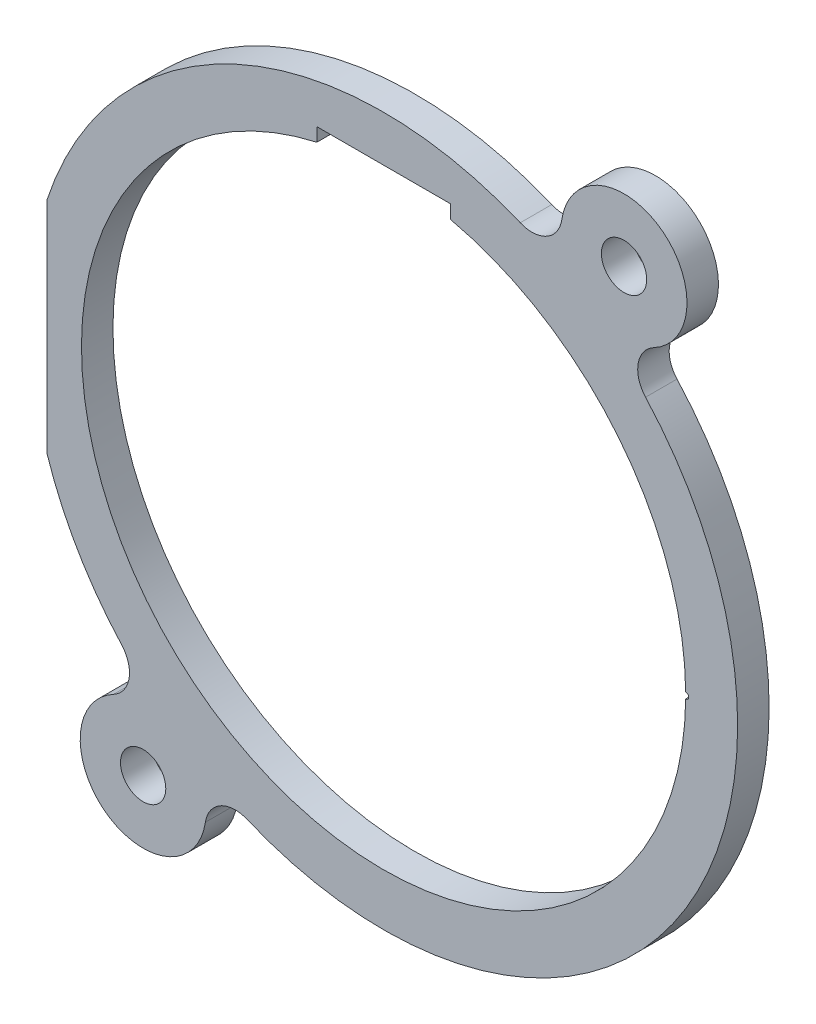
from build123d import *

# Parameters (mm, degrees)
SKETCH1_R           = 1.143
BOSS_EXTRUDE1_DEPTH = 1.5875


with BuildPart() as part:
    # Sketch1 → Boss-Extrude1 (new body)
    with BuildSketch(Plane.XY):
        with BuildLine():
            ThreePointArc((6.893924032, 16.475805386), (-7.445500456, 16.234003654), (-16.984058744, 5.5245))
            Line((-16.984058744, 5.5245), (-16.984058744, -5.5245))
            ThreePointArc((-16.984058744, -5.5245), (-15.444009606, -8.970001058), (-13.214344503, -12.014967792))
            ThreePointArc((-13.214344503, -12.014967792), (-12.840241174, -13.300024042), (-13.624339722, -14.384695574))
            ThreePointArc((-13.624339722, -14.384695574), (-13.960152262, -19.779700621), (-8.989376751, -17.655967979))
            ThreePointArc((-8.989376751, -17.655967979), (-8.230051983, -16.553811563), (-6.893924032, -16.475805386))
            ThreePointArc((-6.893924032, -16.475805386), (14.591708872, -10.298562224), (13.214344503, 12.014967792))
            ThreePointArc((13.214344503, 12.014967792), (12.840241174, 13.300024042), (13.624339722, 14.384695574))
            ThreePointArc((13.624339722, 14.384695574), (13.960152262, 19.779700621), (8.989376751, 17.655967979))
            ThreePointArc((8.989376751, 17.655967979), (8.230051983, 16.553811563), (6.893924032, 16.475805386))
        make_face()
        with BuildLine():
            Line((-3.3655, 14.863748173), (-3.3655, 15.5448))
            Line((-3.3655, 15.5448), (3.3655, 15.5448))
            Line((3.3655, 15.5448), (3.3655, 14.863748173))
            ThreePointArc((3.3655, 14.863748173), (11.859174688, 9.571707043), (15.239238, 0.152398095))
            ThreePointArc((15.239238, 0.152398095), (15.3924, 0), (15.239238, -0.152398095))
            ThreePointArc((15.239238, -0.152398095), (-9.571707043, -11.859174688), (-3.3655, 14.863748173))
        make_face(mode=Mode.SUBTRACT)
        with Locations((12.129357243, 17.185704746)):
            Circle(SKETCH1_R, mode=Mode.SUBTRACT)
        with Locations((-12.129357243, -17.185704746)):
            Circle(SKETCH1_R, mode=Mode.SUBTRACT)
    extrude(amount=BOSS_EXTRUDE1_DEPTH)


solid = part.part
